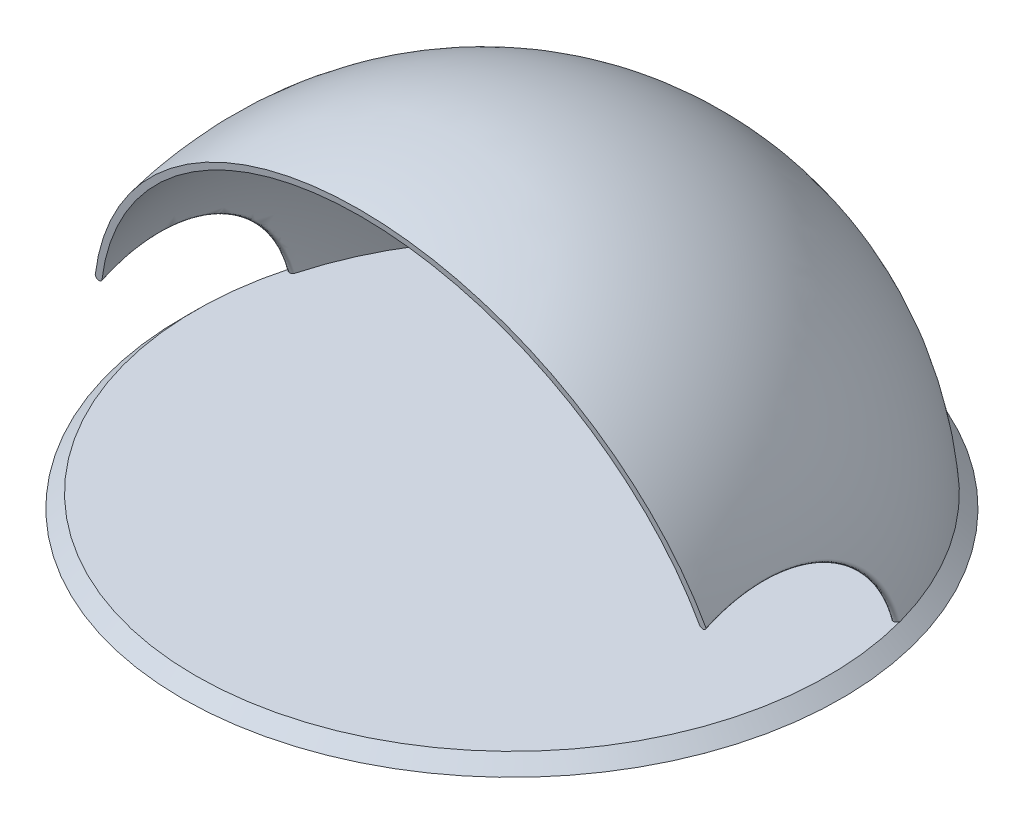
from build123d import *

# Parameters (mm, degrees)
SKETCH1_R           = 500
BOSS_EXTRUDE1_DEPTH = 20
BOSS_EXTRUDE1_TAPER = 45


with BuildPart() as part:
    # Sketch1 → Boss-Extrude1 (new body)
    with BuildSketch(Plane(origin=(0, 0, 0), x_dir=(1, 0, 0), z_dir=(0, 1, 0))):
        Circle(SKETCH1_R)
    extrude(amount=BOSS_EXTRUDE1_DEPTH, taper=BOSS_EXTRUDE1_TAPER)

    # Sweep1: sweep along a path in Sketch3
    with BuildLine(Plane(origin=(0, 0, 0), x_dir=(0, 0, -1), z_dir=(1, 0, 0))) as sweep1_path:
        ThreePointArc((480, 20), (238.376555203, 429.939732355), (-231.026329166, 508))
    # Sketch2 → Sweep1 (sweep)
    with BuildSketch(Plane(origin=(0, 20, 0), x_dir=(1, 0, 0), z_dir=(0, 1, 0))):
        with BuildLine():
            ThreePointArc((-462.894156368, 127), (0, 480), (462.894156368, 127))
            ThreePointArc((462.894156368, 127), (459.395258906, 120.855269204), (453.250528111, 124.354166667))
            ThreePointArc((453.250528111, 124.354166667), (0, 470), (-453.250528111, 124.354166667))
            ThreePointArc((-453.250528111, 124.354166667), (-459.395258906, 120.855269204), (-462.894156368, 127))
        make_face()
    sweep(path=sweep1_path.line)


solid = part.part
